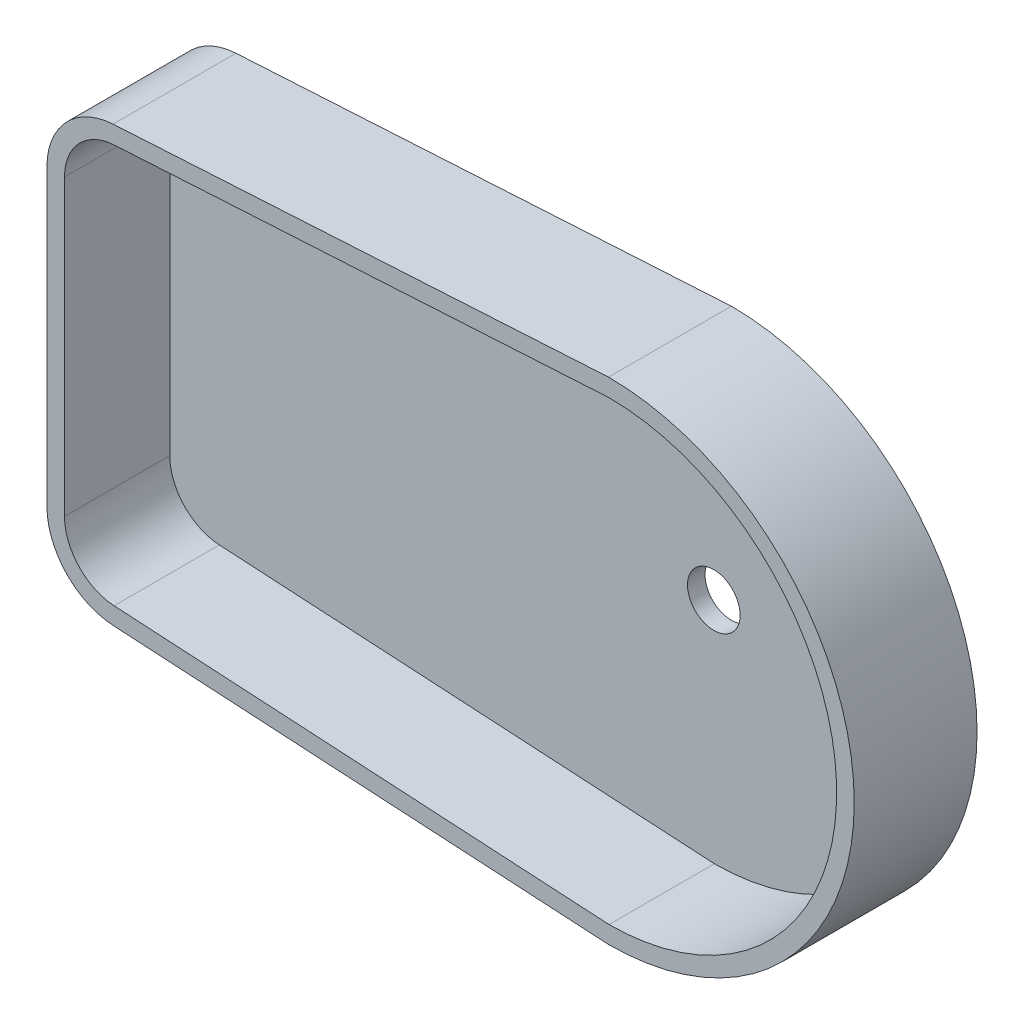
from build123d import *

# Parameters (mm, degrees)
BOSS_EXTRUDE1_DEPTH = 17.5
CUT_EXTRUDE1_DEPTH  = 30
SKETCH6_R           = 7.5
CUT_EXTRUDE2_DEPTH  = 10


with BuildPart() as part:
    # Sketch4 → Boss-Extrude1 (new, symmetric)
    with BuildSketch(Plane.XY):
        with BuildLine():
            Line((0, 41.872855029), (0, -41.872855029))
            ThreePointArc((0, -41.872855029), (5.455474373, -55.600810969), (18.845677428, -61.839515726))
            Line((18.845677428, -61.839515726), (160, -70))
            ThreePointArc((160, -70), (230, 0), (160, 70))
            Line((160, 70), (18.845677428, 61.839515726))
            ThreePointArc((18.845677428, 61.839515726), (5.455474373, 55.600810969), (0, 41.872855029))
        make_face()
    extrude(amount=BOSS_EXTRUDE1_DEPTH, both=True)

    # Sketch5 → Cut-Extrude1 (cut)
    with BuildSketch(Plane.XY.offset(17.5)):
        with BuildLine():
            Line((160.141737643, 64.999845465), (19.134258071, 56.847850552))
            ThreePointArc((19.134258071, 56.847850552), (9.09160578, 52.168821984), (5, 41.872855029))
            Line((5, 41.872855029), (5, -41.872855029))
            ThreePointArc((5, -41.872855029), (9.09160578, -52.168821984), (19.134258071, -56.847850552))
            Line((19.134258071, -56.847850552), (160.141737643, -64.999845465))
            ThreePointArc((160.141737643, -64.999845465), (225, 0), (160.141737643, 64.999845465))
        make_face()
    extrude(amount=-CUT_EXTRUDE1_DEPTH, mode=Mode.SUBTRACT)

    # Sketch6 → Cut-Extrude2 (cut)
    with BuildSketch(Plane(origin=(0, 0, -17.5), x_dir=(-1, 0, 0), z_dir=(0, 0, -1))):
        with Locations((-160, 0)):
            Circle(SKETCH6_R)
    extrude(amount=-CUT_EXTRUDE2_DEPTH, mode=Mode.SUBTRACT)


solid = part.part
